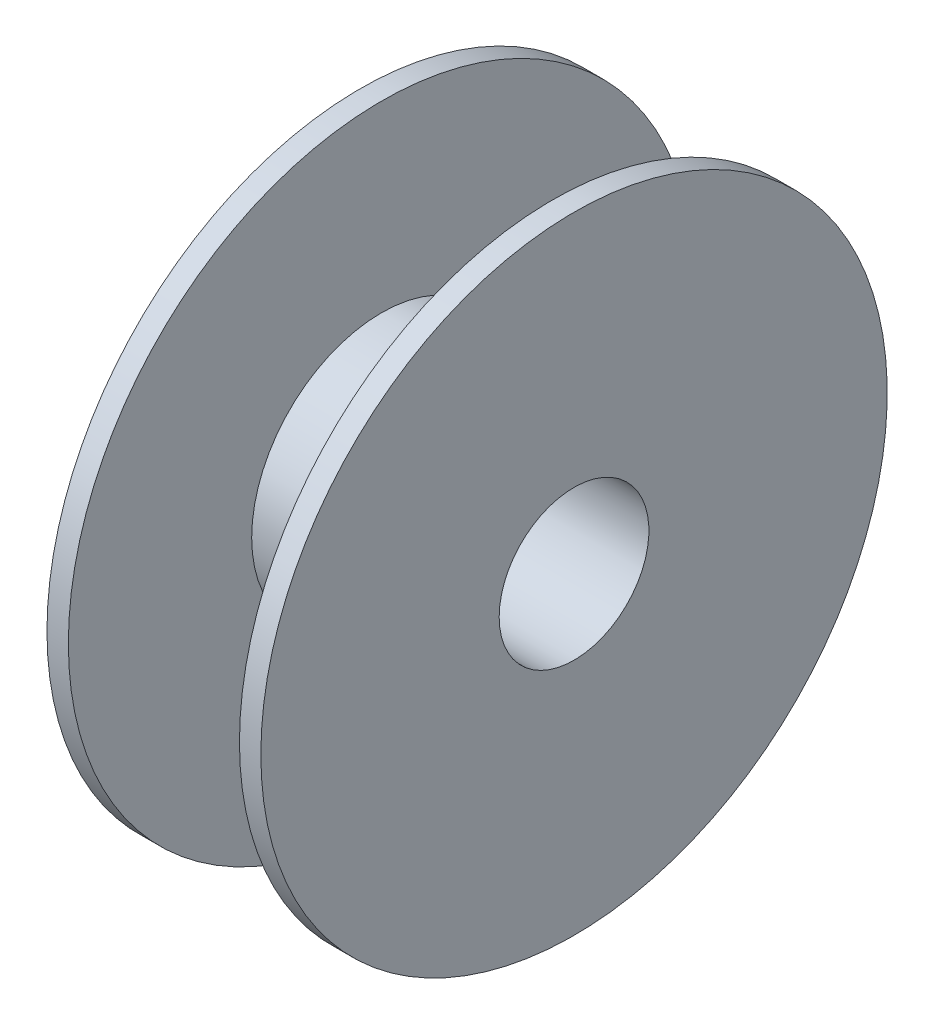
from build123d import *


with BuildPart() as part:
    # Esboço1 → Revolução1 (revolve)
    with BuildSketch(Plane(origin=(0, 0, 0), x_dir=(1, 0, 0), z_dir=(0, 1, 0)), mode=Mode.PRIVATE) as revolu_o1_sk:
        Polygon((-35, 102.5), (-35, 24.5), (35, 24.5), (35, 102.5), (28, 102.5), (28, 42.5), (-28, 42.5), (-28, 102.5), align=None)
    revolve(revolu_o1_sk.sketch.rotate(Axis((-72.731707317, 0, 0), (1, 0, 0)), 180), axis=Axis((-72.731707317, 0, 0), (1, 0, 0)))


solid = part.part
